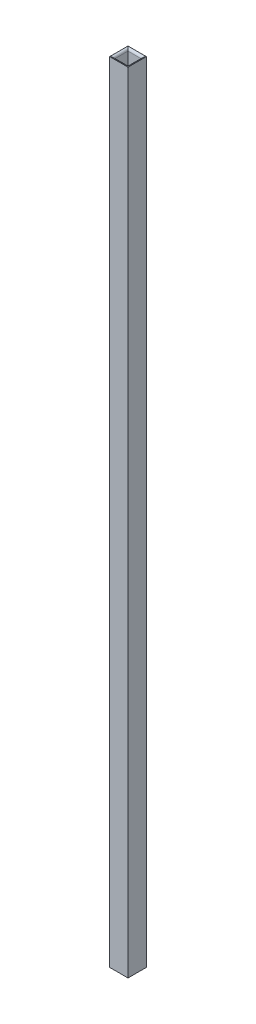
from build123d import *

# Parameters (mm, degrees)
SKETCH1_W           = 13
SKETCH1_H           = 13
BOSS_EXTRUDE1_DEPTH = 558.8
SHELL1_T            = -1.5875
FILLET1_R           = 1.524
FILLET2_R           = 1.524


with BuildPart() as part:
    # Sketch1 → Boss-Extrude1 (new body)
    with BuildSketch(Plane(origin=(0, 0, 0), x_dir=(1, 0, 0), z_dir=(0, 1, 0))):
        with Locations((-9.0448, 10.3402)):
            Rectangle(SKETCH1_W, SKETCH1_H)
    extrude(amount=BOSS_EXTRUDE1_DEPTH)

    # Shell1
    shell1_openings = [part.faces().sort_by_distance(p)[0] for p in [
        (-9.0448, 558.8, -10.3402),
        (-9.0448, 0, -10.3402),
    ]]
    offset(amount=SHELL1_T, openings=shell1_openings, kind=Kind.INTERSECTION)

    # Fillet1
    fillet1_edges = [part.edges().sort_by_distance(p)[0] for p in [
        (-13.9573, 0, -10.3402),
        (-9.0448, 0, -5.4277),
        (-4.1323, 0, -10.3402),
        (-9.0448, 0, -15.2527),
    ]]
    fillet(fillet1_edges, radius=FILLET1_R)

    # Fillet2
    fillet2_edges = [part.edges().sort_by_distance(p)[0] for p in [
        (-13.9573, 558.8, -10.3402),
        (-9.0448, 558.8, -5.4277),
        (-4.1323, 558.8, -10.3402),
        (-9.0448, 558.8, -15.2527),
    ]]
    fillet(fillet2_edges, radius=FILLET2_R)


solid = part.part
